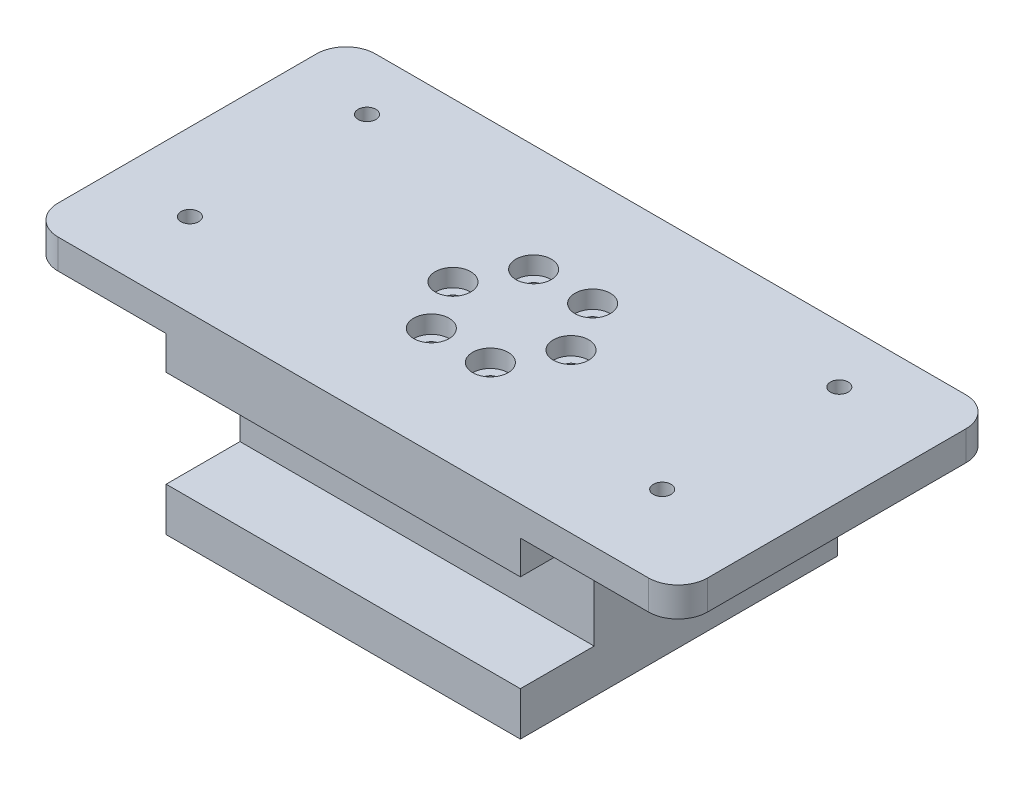
from build123d import *

# Parameters (mm, degrees)
SKETCH1_W           = 60
SKETCH1_H           = 53.75
BOSS_EXTRUDE1_DEPTH = 29.5
SKETCH2_W           = 110
SKETCH2_H           = 53.75
BOSS_EXTRUDE3_DEPTH = 5
SKETCH3_W           = 12.5
SKETCH3_H           = 16.4
CUT_EXTRUDE1_DEPTH  = 108.691307363
SKETCH4_R           = 1.5
CUT_EXTRUDE2_DEPTH  = 108.691307363
SKETCH7_R           = 3
CUT_EXTRUDE3_DEPTH  = 3
SKETCH8_R           = 1.5
CUT_EXTRUDE4_DEPTH  = 108.691307363
FILLET1_R           = 5


with BuildPart() as part:
    # Sketch1 → Boss-Extrude1 (new body)
    with BuildSketch(Plane(origin=(0, 0, 0), x_dir=(1, 0, 0), z_dir=(0, 1, 0))):
        with Locations((30, 26.875)):
            Rectangle(SKETCH1_W, SKETCH1_H)
    extrude(amount=BOSS_EXTRUDE1_DEPTH)

    # Sketch2 → Boss-Extrude3 (add)
    with BuildSketch(Plane(origin=(0, 29.5, 0), x_dir=(1, 0, 0), z_dir=(0, 1, 0))):
        with Locations((31.707007684, 26.875)):
            Rectangle(SKETCH2_W, SKETCH2_H)
    extrude(amount=BOSS_EXTRUDE3_DEPTH)

    # Sketch3 → Cut-Extrude1 (cut, through all)
    with BuildSketch(Plane.ZY):
        with Locations((-6.25, 15.6)):
            Rectangle(SKETCH3_W, SKETCH3_H)
    extrude(amount=-CUT_EXTRUDE1_DEPTH, mode=Mode.SUBTRACT)

    # Sketch4 → Cut-Extrude2 (cut, through all)
    with BuildSketch(Plane(origin=(0, 34.5, 0), x_dir=(1, 0, 0), z_dir=(0, 1, 0))):
        with Locations(Location((-10.132992316, 14.155, 0), (0, 0, 270))):
            Circle(SKETCH4_R)
        with Locations(Location((69.867007684, 14.155, 0), (0, 0, 270))):
            Circle(SKETCH4_R)
        with Locations(Location((-10.132992316, 44.155, 0), (0, 0, 270))):
            Circle(SKETCH4_R)
        with Locations(Location((69.867007684, 44.155, 0), (0, 0, 270))):
            Circle(SKETCH4_R)
    extrude(amount=-CUT_EXTRUDE2_DEPTH, mode=Mode.SUBTRACT)

    # Sketch7 → Cut-Extrude3 (cut)
    with BuildSketch(Plane(origin=(0, 34.5, 0), x_dir=(1, 0, 0), z_dir=(0, 1, 0))):
        with Locations(Location((41.707007684, 26.875, 0), (0, 0, 270))):
            Circle(SKETCH7_R)
        with Locations(Location((36.707007684, 18.214745962, 0), (0, 0, 270))):
            Circle(SKETCH7_R)
        with Locations(Location((26.707007684, 18.214745962, 0), (0, 0, 270))):
            Circle(SKETCH7_R)
        with Locations(Location((21.707007684, 26.875, 0), (0, 0, 270))):
            Circle(SKETCH7_R)
        with Locations(Location((26.707007684, 35.535254038, 0), (0, 0, 270))):
            Circle(SKETCH7_R)
        with Locations(Location((36.707007684, 35.535254038, 0), (0, 0, 270))):
            Circle(SKETCH7_R)
    extrude(amount=-CUT_EXTRUDE3_DEPTH, mode=Mode.SUBTRACT)

    # Sketch8 → Cut-Extrude4 (cut, through all)
    with BuildSketch(Plane(origin=(0, 34.5, 0), x_dir=(1, 0, 0), z_dir=(0, 1, 0))):
        with Locations(Location((41.707007684, 26.875, 0), (0, 0, 270))):
            Circle(SKETCH8_R)
        with Locations(Location((36.707007684, 18.214745962, 0), (0, 0, 270))):
            Circle(SKETCH8_R)
        with Locations(Location((26.707007684, 18.214745962, 0), (0, 0, 270))):
            Circle(SKETCH8_R)
        with Locations(Location((21.707007684, 26.875, 0), (0, 0, 270))):
            Circle(SKETCH8_R)
        with Locations(Location((26.707007684, 35.535254038, 0), (0, 0, 270))):
            Circle(SKETCH8_R)
        with Locations(Location((36.707007684, 35.535254038, 0), (0, 0, 270))):
            Circle(SKETCH8_R)
    extrude(amount=-CUT_EXTRUDE4_DEPTH, mode=Mode.SUBTRACT)

    # Fillet1
    fillet1_edges = [part.edges().sort_by_distance(p)[0] for p in [
        (-23.292992316, 32, -53.75),
        (-23.292992316, 32, 0),
        (86.707007684, 32, 0),
        (86.707007684, 32, -53.75),
    ]]
    fillet(fillet1_edges, radius=FILLET1_R)


solid = part.part
